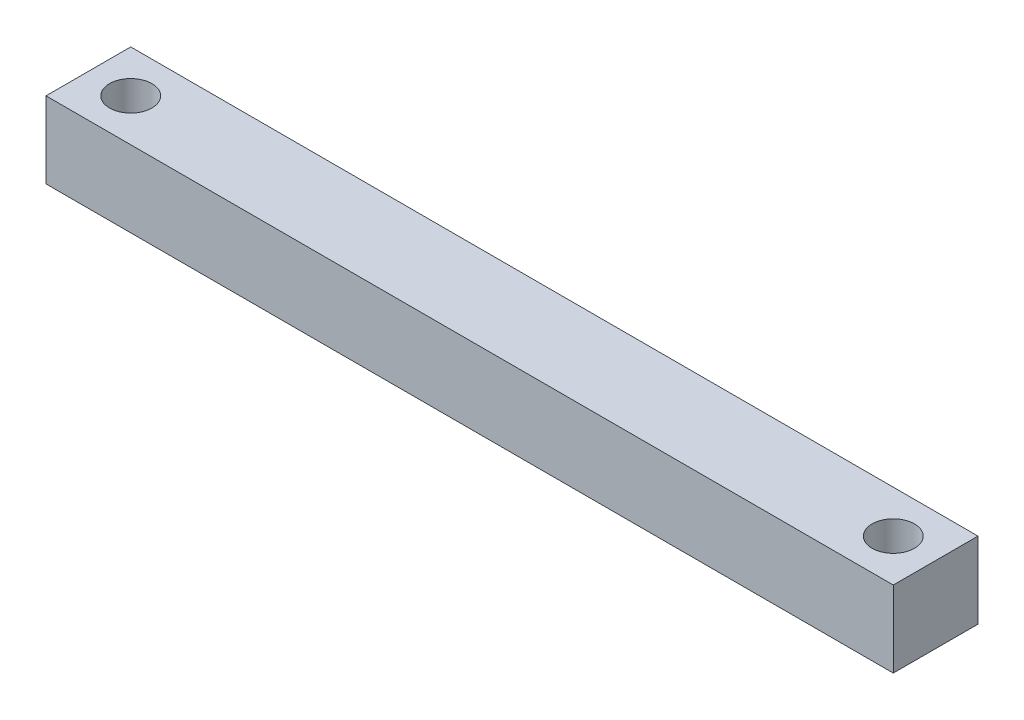
from build123d import *

# Parameters (mm, degrees)
SKETCH_V_W          = 100
SKETCH_V_H          = 10
BOSS_EXTRUDE1_DEPTH = 9.004889001
SKETCH2_R           = 2.5
CUT_EXTRUDE1_DEPTH  = 52.049858236


with BuildPart() as part:
    # Sketch v → Boss-Extrude1 (new body)
    with BuildSketch(Plane(origin=(0, 0, 0), x_dir=(1, 0, 0), z_dir=(0, 1, 0))):
        Rectangle(SKETCH_V_W, SKETCH_V_H)
    extrude(amount=BOSS_EXTRUDE1_DEPTH)

    # Sketch2 → Cut-Extrude1 (cut, through all)
    with BuildSketch(Plane(origin=(0, 9.004889001, 0), x_dir=(1, 0, 0), z_dir=(0, 1, 0))):
        with Locations(Location((-45, 0, 0), (0, 0, 270))):
            Circle(SKETCH2_R)
        with Locations(Location((45, 0, 0), (0, 0, 270))):
            Circle(SKETCH2_R)
    extrude(amount=-CUT_EXTRUDE1_DEPTH, mode=Mode.SUBTRACT)


solid = part.part
